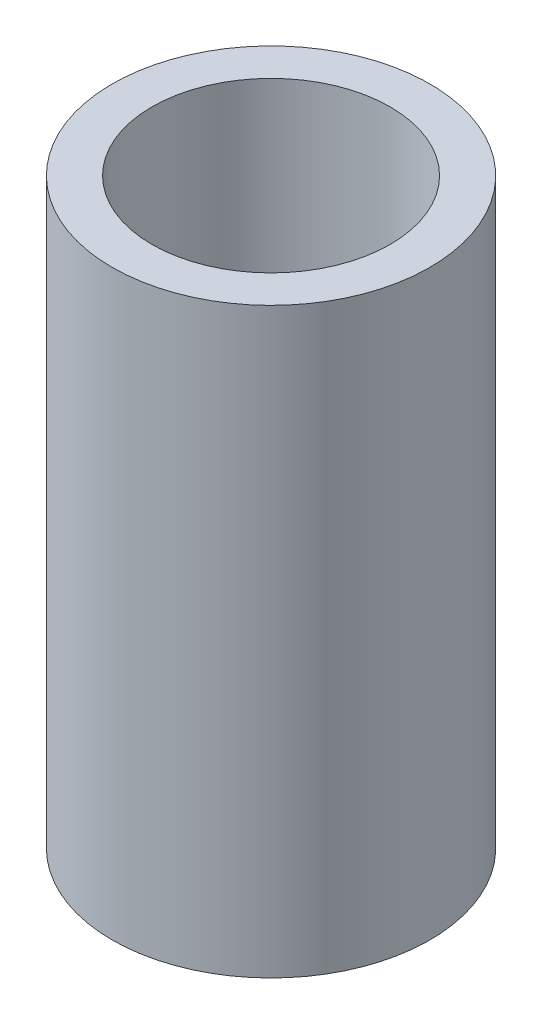
from build123d import *

# Parameters (mm, degrees)
ESQUISSE1_R        = 3
ESQUISSE1_R_2      = 2.25
BOSS_EXTRU_1_DEPTH = 11


with BuildPart() as part:
    # Esquisse1 → Boss.-Extru.1 (new body)
    with BuildSketch(Plane(origin=(0, 0, 0), x_dir=(1, 0, 0), z_dir=(0, 1, 0))):
        with Locations(Location((0, 0, 0), (0, 0, 270))):
            Circle(ESQUISSE1_R)
        with Locations(Location((0, 0, 0), (0, 0, 270))):
            Circle(ESQUISSE1_R_2, mode=Mode.SUBTRACT)
    extrude(amount=BOSS_EXTRU_1_DEPTH)


solid = part.part
